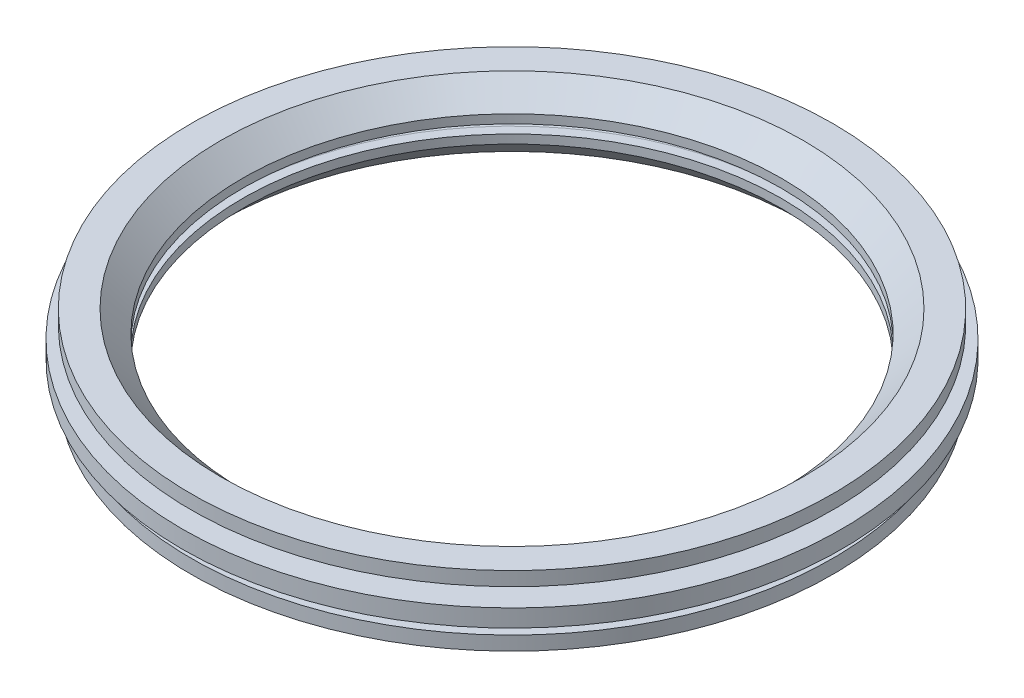
from build123d import *


with BuildPart() as part:
    # Sketch1 → Revolve1 (revolve)
    with BuildSketch(Plane.XY, mode=Mode.PRIVATE) as revolve1_sk:
        with BuildLine():
            Line((49.022, 0.79375), (49.022, 2.38125))
            Line((49.022, 2.38125), (52.99075, 6.35))
            Line((52.99075, 6.35), (58.3565, 6.35))
            Line((58.3565, 6.35), (58.3565, 3.81))
            Line((58.3565, 3.81), (53.2765, 3.81))
            Line((53.2765, 3.81), (53.2765, 1.5875))
            Line((53.2765, 1.5875), (59.944, 1.5875))
            Line((59.944, 1.5875), (59.944, 0))
            Line((59.944, 0), (51.562, 0))
            ThreePointArc((51.562, 0), (51.329516008, 0.561266008), (50.76825, 0.79375))
            Line((50.76825, 0.79375), (49.022, 0.79375))
        make_face()
    revolve1 = revolve(revolve1_sk.sketch.rotate(Axis((0, 0, 0), (0, 1, 0)), 90), axis=Axis((0, 0, 0), (0, 1, 0)))

    # Mirror1: Revolve1 across plane
    add(revolve1.mirror(Plane.ZX))


solid = part.part
